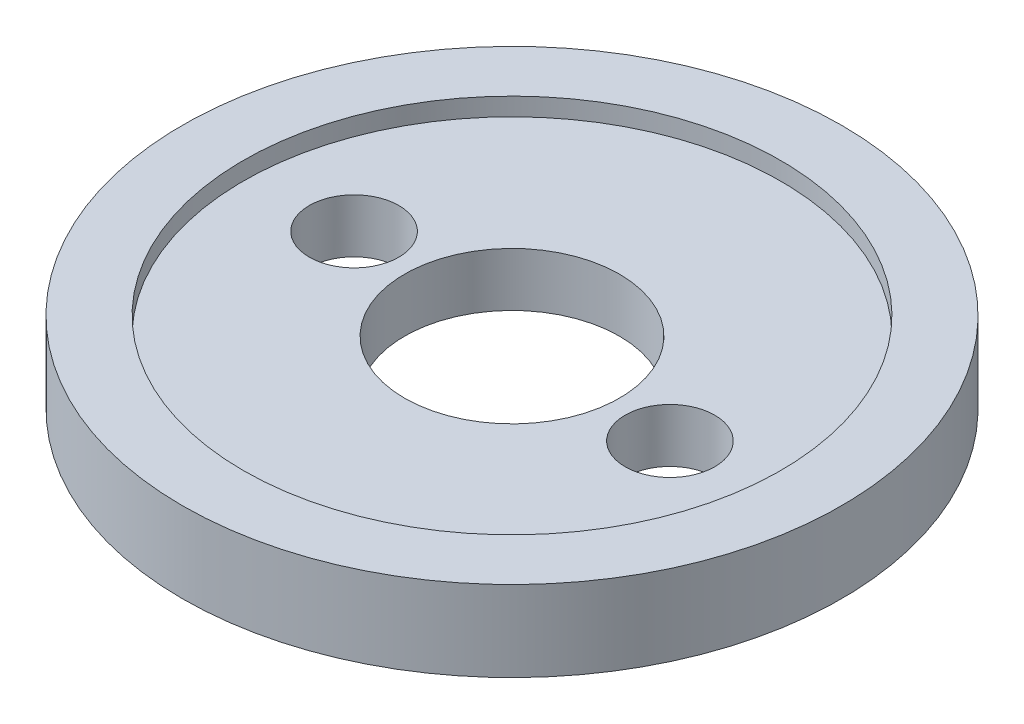
from build123d import *

# Parameters (mm, degrees)
SKETCH1_R           = 18.4
BOSS_EXTRUDE1_DEPTH = 4.5
SKETCH2_R           = 15
CUT_EXTRUDE1_DEPTH  = 1
SKETCH3_R           = 2.5
CUT_EXTRUDE2_DEPTH  = 27.40776401
CUT_EXTRUDE3_START  = -0.5
SKETCH4_R           = 15
CUT_EXTRUDE3_DEPTH  = 0.5
SKETCH5_R           = 6
CUT_EXTRUDE4_DEPTH  = 27.25585649


with BuildPart() as part:
    # Sketch1 → Boss-Extrude1 (new body)
    with BuildSketch(Plane(origin=(0, 0, 0), x_dir=(1, 0, 0), z_dir=(0, 1, 0))):
        with Locations(Location((0, 0, 0), (0, 0, 270))):
            Circle(SKETCH1_R)
    extrude(amount=BOSS_EXTRUDE1_DEPTH)

    # Sketch2 → Cut-Extrude1 (cut)
    with BuildSketch(Plane(origin=(0, 4.5, 0), x_dir=(1, 0, 0), z_dir=(0, 1, 0))):
        with Locations(Location((0, 0, 0), (0, 0, 270))):
            Circle(SKETCH2_R)
    extrude(amount=-CUT_EXTRUDE1_DEPTH, mode=Mode.SUBTRACT)

    # Sketch3 → Cut-Extrude2 (cut, through all)
    with BuildSketch(Plane.XZ):
        with Locations(Location((-9.477141659, -0.658624302, 0), (0, 0, 270))):
            Circle(SKETCH3_R)
        with Locations(Location((9.477141659, 0.658624302, 0), (0, 0, 270))):
            Circle(SKETCH3_R)
    extrude(amount=-CUT_EXTRUDE2_DEPTH, mode=Mode.SUBTRACT)

    # Sketch4 → Cut-Extrude3 (cut)
    with BuildSketch(Plane.XZ.offset(CUT_EXTRUDE3_START)):
        with Locations(Location((0, 0, 0), (0, 0, 90))):
            Circle(SKETCH4_R)
    extrude(amount=CUT_EXTRUDE3_DEPTH, mode=Mode.SUBTRACT)

    # Sketch5 → Cut-Extrude4 (cut, through all)
    with BuildSketch(Plane(origin=(0, 3.5, 0), x_dir=(1, 0, 0), z_dir=(0, 1, 0))):
        with Locations(Location((0, 0, 0), (0, 0, 270))):
            Circle(SKETCH5_R)
    extrude(amount=-CUT_EXTRUDE4_DEPTH, mode=Mode.SUBTRACT)


solid = part.part
